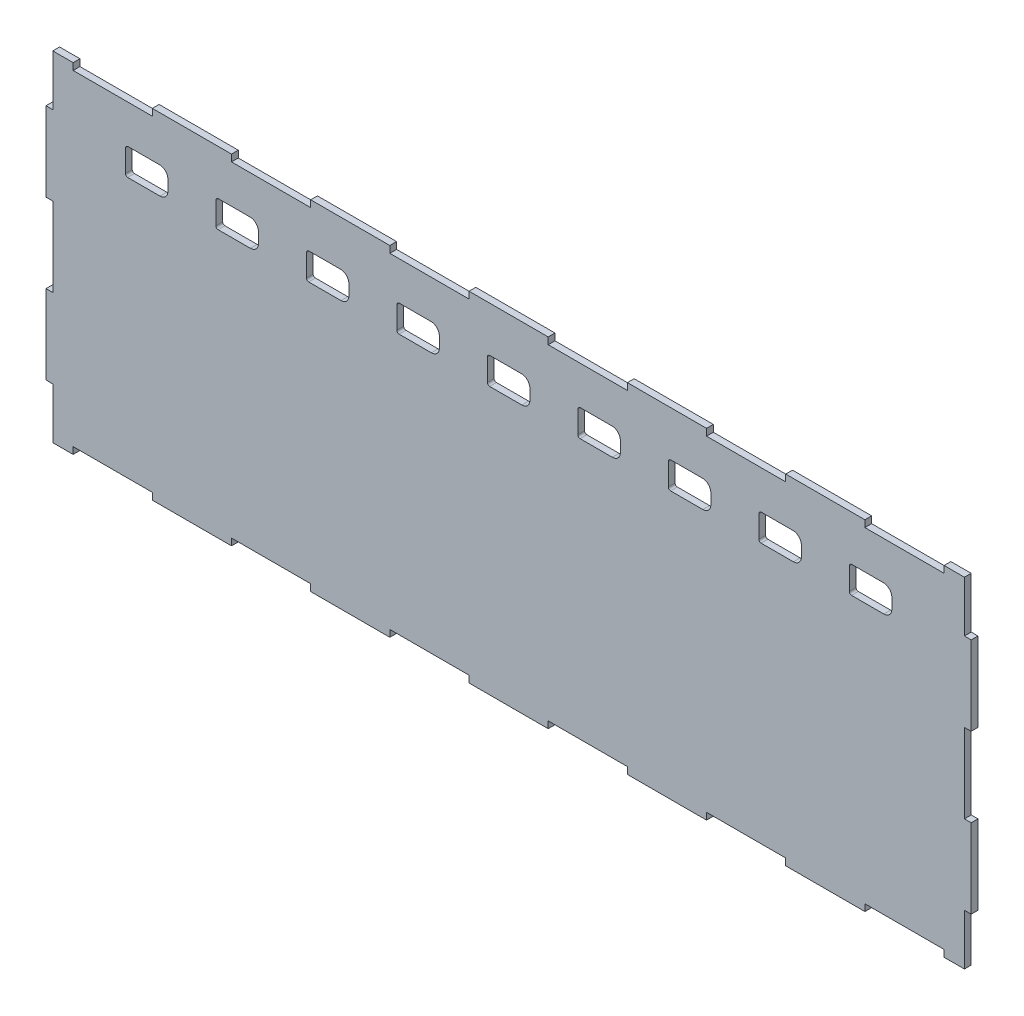
from build123d import *

# Parameters (mm, degrees)
BOSS_EXTRUDE1_DEPTH = 3
CUT_EXTRUDE1_DEPTH  = 218.839964194


with BuildPart() as part:
    # Model → Boss-Extrude1 (new body)
    with BuildSketch(Plane.XY):
        Polygon((201.5, 75), (192.5, 75), (192.5, 72), (157.5, 72), (157.5, 75), (122.5, 75), (122.5, 72), (87.5, 72), (87.5, 75), (52.5, 75), (52.5, 72), (17.5, 72), (17.5, 75), (-17.5, 75), (-17.5, 72), (-52.5, 72), (-52.5, 75), (-87.5, 75), (-87.5, 72), (-122.5, 72), (-122.5, 75), (-157.5, 75), (-157.5, 72), (-192.5, 72), (-192.5, 75), (-201.5, 75), (-201.5, 72), (-201.5, 52.5), (-204.5, 52.5), (-204.5, 17.5), (-201.5, 17.5), (-201.5, -17.5), (-204.5, -17.5), (-204.5, -52.5), (-201.5, -52.5), (-201.5, -72), (-201.5, -75), (-192.5, -75), (-192.5, -72), (-157.5, -72), (-157.5, -75), (-122.5, -75), (-122.5, -72), (-87.5, -72), (-87.5, -75), (-52.5, -75), (-52.5, -72), (-17.5, -72), (-17.5, -75), (17.5, -75), (17.5, -72), (52.5, -72), (52.5, -75), (87.5, -75), (87.5, -72), (122.5, -72), (122.5, -75), (157.5, -75), (157.5, -72), (192.5, -72), (192.5, -75), (201.5, -75), (201.5, -72), (201.5, -52.5), (204.5, -52.5), (204.5, -17.5), (201.5, -17.5), (201.5, 17.5), (204.5, 17.5), (204.5, 52.5), (201.5, 52.5), (201.5, 72), align=None)
    extrude(amount=BOSS_EXTRUDE1_DEPTH)

    # Sketch1 → Cut-Extrude1 (cut, through all)
    with BuildSketch(Plane.XY.offset(3)):
        with BuildLine():
            Line((-154.125, 43.1), (-168.4, 43.1))
            ThreePointArc((-168.4, 43.1), (-169.107106781, 43.392893219), (-169.4, 44.1))
            Line((-169.4, 44.1), (-169.4, 53.8))
            ThreePointArc((-169.4, 53.8), (-169.048528137, 54.648528137), (-168.2, 55))
            Line((-168.2, 55), (-154.325, 55))
            ThreePointArc((-154.325, 55), (-151.69102724, 53.90897276), (-150.6, 51.275))
            Line((-150.6, 51.275), (-150.6, 46.625))
            ThreePointArc((-150.6, 46.625), (-151.632448596, 44.132448596), (-154.125, 43.1))
        make_face()
        with BuildLine():
            Line((-114.125, 43.1), (-128.4, 43.1))
            ThreePointArc((-128.4, 43.1), (-129.107106781, 43.392893219), (-129.4, 44.1))
            Line((-129.4, 44.1), (-129.4, 53.8))
            ThreePointArc((-129.4, 53.8), (-129.048528137, 54.648528137), (-128.2, 55))
            Line((-128.2, 55), (-114.325, 55))
            ThreePointArc((-114.325, 55), (-111.69102724, 53.90897276), (-110.6, 51.275))
            Line((-110.6, 51.275), (-110.6, 46.625))
            ThreePointArc((-110.6, 46.625), (-111.632448596, 44.132448596), (-114.125, 43.1))
        make_face()
        with BuildLine():
            Line((-74.125, 43.1), (-88.4, 43.1))
            ThreePointArc((-88.4, 43.1), (-89.107106781, 43.392893219), (-89.4, 44.1))
            Line((-89.4, 44.1), (-89.4, 53.8))
            ThreePointArc((-89.4, 53.8), (-89.048528137, 54.648528137), (-88.2, 55))
            Line((-88.2, 55), (-74.325, 55))
            ThreePointArc((-74.325, 55), (-71.69102724, 53.90897276), (-70.6, 51.275))
            Line((-70.6, 51.275), (-70.6, 46.625))
            ThreePointArc((-70.6, 46.625), (-71.632448596, 44.132448596), (-74.125, 43.1))
        make_face()
        with BuildLine():
            Line((-34.125, 43.1), (-48.4, 43.1))
            ThreePointArc((-48.4, 43.1), (-49.107106781, 43.392893219), (-49.4, 44.1))
            Line((-49.4, 44.1), (-49.4, 53.8))
            ThreePointArc((-49.4, 53.8), (-49.048528137, 54.648528137), (-48.2, 55))
            Line((-48.2, 55), (-34.325, 55))
            ThreePointArc((-34.325, 55), (-31.69102724, 53.90897276), (-30.6, 51.275))
            Line((-30.6, 51.275), (-30.6, 46.625))
            ThreePointArc((-30.6, 46.625), (-31.632448596, 44.132448596), (-34.125, 43.1))
        make_face()
        with BuildLine():
            Line((5.875, 43.1), (-8.4, 43.1))
            ThreePointArc((-8.4, 43.1), (-9.107106781, 43.392893219), (-9.4, 44.1))
            Line((-9.4, 44.1), (-9.4, 53.8))
            ThreePointArc((-9.4, 53.8), (-9.048528137, 54.648528137), (-8.2, 55))
            Line((-8.2, 55), (5.675, 55))
            ThreePointArc((5.675, 55), (8.30897276, 53.90897276), (9.4, 51.275))
            Line((9.4, 51.275), (9.4, 46.625))
            ThreePointArc((9.4, 46.625), (8.367551404, 44.132448596), (5.875, 43.1))
        make_face()
        with BuildLine():
            Line((45.875, 43.1), (31.6, 43.1))
            ThreePointArc((31.6, 43.1), (30.892893219, 43.392893219), (30.6, 44.1))
            Line((30.6, 44.1), (30.6, 53.8))
            ThreePointArc((30.6, 53.8), (30.951471863, 54.648528137), (31.8, 55))
            Line((31.8, 55), (45.675, 55))
            ThreePointArc((45.675, 55), (48.30897276, 53.90897276), (49.4, 51.275))
            Line((49.4, 51.275), (49.4, 46.625))
            ThreePointArc((49.4, 46.625), (48.367551404, 44.132448596), (45.875, 43.1))
        make_face()
        with BuildLine():
            Line((85.875, 43.1), (71.6, 43.1))
            ThreePointArc((71.6, 43.1), (70.892893219, 43.392893219), (70.6, 44.1))
            Line((70.6, 44.1), (70.6, 53.8))
            ThreePointArc((70.6, 53.8), (70.951471863, 54.648528137), (71.8, 55))
            Line((71.8, 55), (85.675, 55))
            ThreePointArc((85.675, 55), (88.30897276, 53.90897276), (89.4, 51.275))
            Line((89.4, 51.275), (89.4, 46.625))
            ThreePointArc((89.4, 46.625), (88.367551404, 44.132448596), (85.875, 43.1))
        make_face()
        with BuildLine():
            Line((125.875, 43.1), (111.6, 43.1))
            ThreePointArc((111.6, 43.1), (110.892893219, 43.392893219), (110.6, 44.1))
            Line((110.6, 44.1), (110.6, 53.8))
            ThreePointArc((110.6, 53.8), (110.951471863, 54.648528137), (111.8, 55))
            Line((111.8, 55), (125.675, 55))
            ThreePointArc((125.675, 55), (128.30897276, 53.90897276), (129.4, 51.275))
            Line((129.4, 51.275), (129.4, 46.625))
            ThreePointArc((129.4, 46.625), (128.367551404, 44.132448596), (125.875, 43.1))
        make_face()
        with BuildLine():
            Line((165.875, 43.1), (151.6, 43.1))
            ThreePointArc((151.6, 43.1), (150.892893219, 43.392893219), (150.6, 44.1))
            Line((150.6, 44.1), (150.6, 53.8))
            ThreePointArc((150.6, 53.8), (150.951471863, 54.648528137), (151.8, 55))
            Line((151.8, 55), (165.675, 55))
            ThreePointArc((165.675, 55), (168.30897276, 53.90897276), (169.4, 51.275))
            Line((169.4, 51.275), (169.4, 46.625))
            ThreePointArc((169.4, 46.625), (168.367551404, 44.132448596), (165.875, 43.1))
        make_face()
    extrude(amount=-CUT_EXTRUDE1_DEPTH, mode=Mode.SUBTRACT)


solid = part.part
